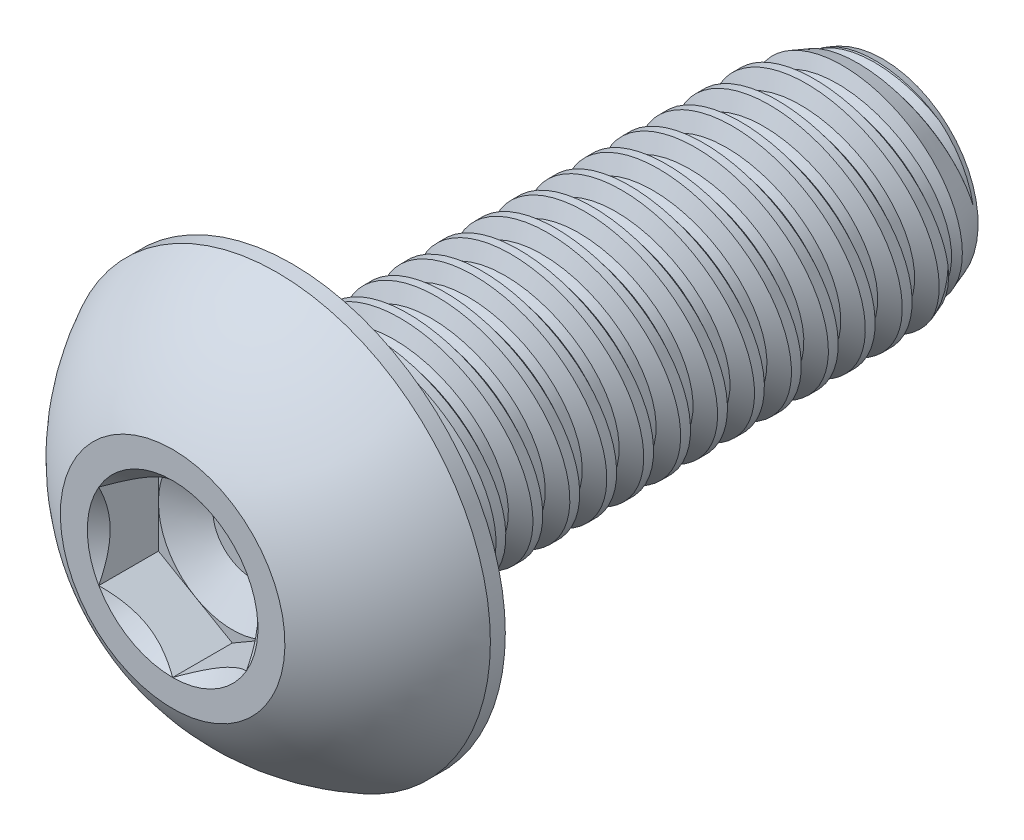
from build123d import *

# Parameters (mm, degrees)
SKETCH1_W          = 12.7
SKETCH1_H          = 2.413
LPATTERN1_COUNT    = 16
LPATTERN1_PITCH    = 0.79375
LPATTERN2_COUNT    = 2
LPATTERN2_PITCH    = 0.79375
SKETCH4_R          = 4.5847
EXTRUDE1_DEPTH     = 2.5654
CUT_EXTRUDE1_DEPTH = 1.2827
SKETCH7_R          = 1.833087105
CUT_EXTRUDE4_DEPTH = 1.2827
CUT_EXTRUDE4_DRAFT = -45
SKETCH8_R          = 1.5875
CUT_EXTRUDE5_DEPTH = 0.427566667
CUT_EXTRUDE5_DRAFT = -60


with BuildPart() as part:
    # Sketch1 → Revolve1 (revolve)
    with BuildSketch(Plane(origin=(0, 0, 0), x_dir=(0, 0, -1), z_dir=(1, 0, 0))):
        with Locations((6.35, 1.2065)):
            Rectangle(SKETCH1_W, SKETCH1_H)
    revolve(axis=Axis((0, 0, 0), (0, 0, 1)))

    # Sketch2 → Cut-Revolve1 (revolve, cut)
    with BuildSketch(Plane(origin=(0, 0, 0), x_dir=(0, 0, -1), z_dir=(1, 0, 0)), mode=Mode.PRIVATE) as cut_revolve1_sk:
        Polygon((0.097903365, 2.429102527), (0.783226924, 2.541820218), (0.608194498, 2.077629892), (0.412387767, 2.045424837), align=None)
    cut_revolve1 = revolve(cut_revolve1_sk.sketch.rotate(Axis((0, -0.139697061, 0), (0, 0.16229318767089765, -0.9867425810390564)), 180), axis=Axis((0, -0.139697061, 0), (0, 0.16229318767089765, -0.9867425810390564)), mode=Mode.SUBTRACT)

    # Sketch3 → Cut-Revolve2 (revolve, cut)
    with BuildSketch(Plane(origin=(0, 0, 0), x_dir=(0, 0, -1), z_dir=(1, 0, 0))):
        Polygon((12.7, 2.045424837), (11.69009554, 2.413), (12.7, 2.413), align=None)
    revolve(axis=Axis((0, 0, -11.69009554), (0, 0, 1)), mode=Mode.SUBTRACT)

    # LPattern1: Cut-Revolve1 ×16
    with Locations(*[(0, 0, -i * LPATTERN1_PITCH) for i in range(1, LPATTERN1_COUNT)]):
        add(cut_revolve1, mode=Mode.SUBTRACT)

    # LPattern2: Cut-Revolve1 ×2
    with Locations(*[(0, 0, i * LPATTERN2_PITCH) for i in range(1, LPATTERN2_COUNT)]):
        add(cut_revolve1, mode=Mode.SUBTRACT)

    # Sketch4 → Extrude1 (add)
    with BuildSketch(Plane.XY):
        Circle(SKETCH4_R)
    extrude(amount=EXTRUDE1_DEPTH)

    # Sketch9 → Cut-Revolve3 (revolve, cut)
    with BuildSketch(Plane(origin=(0, 0, 0), x_dir=(0, 0, -1), z_dir=(1, 0, 0)), mode=Mode.PRIVATE) as cut_revolve3_sk:
        with BuildLine():
            Line((0, 4.5847), (-0.320675, 4.5847))
            ThreePointArc((-0.320675, 4.5847), (-1.612933614, 3.674458995), (-2.5654, 2.413))
            Line((-2.5654, 2.413), (-2.886075, 2.413))
            Line((-2.886075, 2.413), (-2.886075, 4.905375))
            Line((-2.886075, 4.905375), (0, 4.905375))
            Line((0, 4.905375), (0, 4.5847))
        make_face()
    revolve(cut_revolve3_sk.sketch.rotate(Axis((0, 0, 0), (0, 0, 1)), 124.585194502), axis=Axis((0, 0, 0), (0, 0, 1)), mode=Mode.SUBTRACT)

    # Sketch6 → Cut-Extrude1 (cut)
    with BuildSketch(Plane.XY.offset(2.5654)):
        Polygon((0, -1.833087105), (1.5875, -0.916543552), (1.5875, 0.916543552), (0, 1.833087105), (-1.5875, 0.916543552), (-1.5875, -0.916543552), align=None)
    extrude(amount=-CUT_EXTRUDE1_DEPTH, mode=Mode.SUBTRACT)


with BuildPart() as cut_extrude4_tool:
    # Sketch7 → Cut-Extrude4 (with draft: the straight prism first)
    with BuildSketch(Plane.XY.offset(2.5654)):
        Circle(SKETCH7_R)
    extrude(amount=-CUT_EXTRUDE4_DEPTH)
    # Cut-Extrude4: the draft: its side faces are tilted about the plane it starts from
    cut_extrude4_sides = [cut_extrude4_tool.faces().sort_by_distance(p)[0] for p in [
        (-1.833087105, 0, 1.92405),
    ]]
    draft(cut_extrude4_sides, Plane.XY.offset(2.5654), CUT_EXTRUDE4_DRAFT)


with BuildPart() as part_1:
    add(part.part)

    # Cut-Extrude4: cut by cut_extrude4_tool
    add(cut_extrude4_tool.part, mode=Mode.SUBTRACT)


with BuildPart() as cut_extrude5_tool:
    # Sketch8 → Cut-Extrude5 (with draft: the straight prism first)
    with BuildSketch(Plane.XY.offset(1.2827)):
        Circle(SKETCH8_R)
    extrude(amount=-CUT_EXTRUDE5_DEPTH)
    # Cut-Extrude5: the draft: its side faces are tilted about the plane it starts from
    cut_extrude5_sides = [cut_extrude5_tool.faces().sort_by_distance(p)[0] for p in [
        (-1.5875, 0, 1.068916667),
    ]]
    draft(cut_extrude5_sides, Plane.XY.offset(1.2827), CUT_EXTRUDE5_DRAFT)


with BuildPart() as part_2:
    add(part_1.part)

    # Cut-Extrude5: cut by cut_extrude5_tool
    add(cut_extrude5_tool.part, mode=Mode.SUBTRACT)


solid = part_2.part
